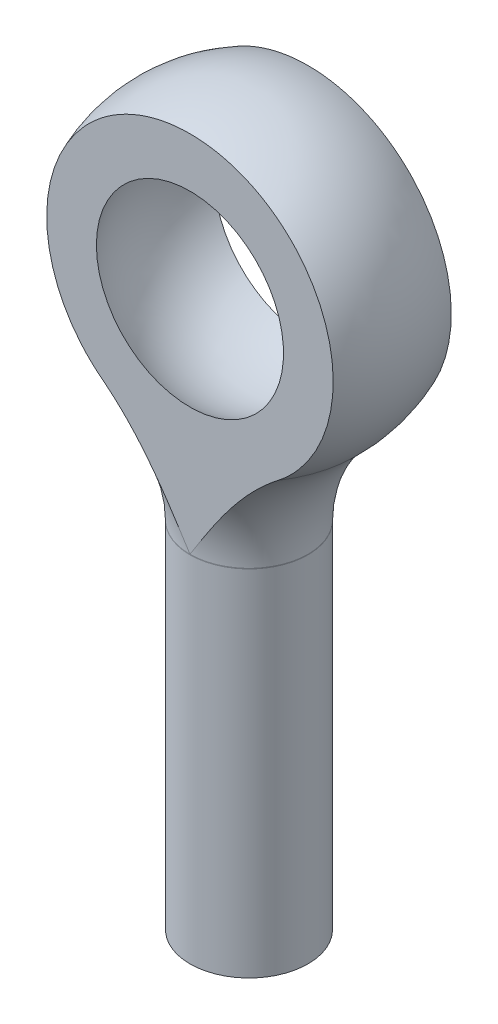
from build123d import *

# Parameters (mm, degrees)
EXTRUDE4_REACH = 84.044
SKETCH3_R      = 6.35
FILLET4_R      = 15.875
SKETCH2_W      = 55.88
SKETCH2_H      = 50.8
EXTRUDE3_DEPTH = 69.131758637


with BuildPart() as part:
    # Sketch1 → Revolve2 (revolve)
    with BuildSketch(Plane.XY):
        with BuildLine():
            Line((0, 11.8999), (0, 16.6624))
            ThreePointArc((0, 16.6624), (-16.6624, 0), (0, -16.6624))
            Line((0, -16.6624), (0, -11.8999))
            ThreePointArc((0, -11.8999), (-11.8999, 0), (0, 11.8999))
        make_face()
    revolve(axis=Axis((0, 0, 0), (0, 1, 0)))

    # Sketch3 → Extrude4 (add, up to next)
    with BuildSketch(Plane(origin=(0, -61.9252, 0), x_dir=(-1, 0, 0), z_dir=(0, 1, 0)), mode=Mode.PRIVATE) as extrude4_sk1:
        Circle(SKETCH3_R)
    extrude4_tool1 = extrude(extrude4_sk1.sketch, amount=EXTRUDE4_REACH, mode=Mode.PRIVATE) - part.part
    add(extrude4_tool1.solids().sort_by_distance((0, -61.9252, 0))[0])

    # Fillet4
    fillet4_edges = [part.edges().sort_by_distance(p)[0] for p in [
        (6.35, -15.404969126, 0),
    ]]
    fillet(fillet4_edges, radius=FILLET4_R)

    # Sketch2 → Extrude3 (cut, through all)
    with BuildSketch(Plane.XY.offset(-6.35)):
        Rectangle(SKETCH2_W, SKETCH2_H)
    extrude3 = extrude(amount=-EXTRUDE3_DEPTH, mode=Mode.SUBTRACT)

    # Mirror1: Extrude3 across plane
    add(extrude3.mirror(Plane.XY), mode=Mode.SUBTRACT)


solid = part.part
